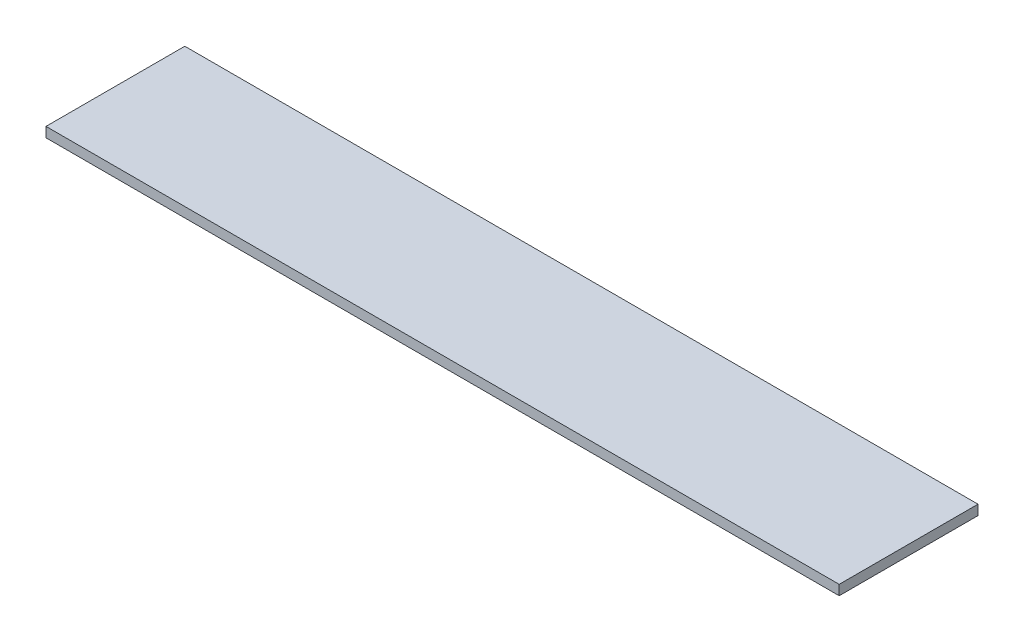
from build123d import *

# Parameters (mm, degrees)
SKETCH1_W           = 254
SKETCH1_H           = 44.45
BOSS_EXTRUDE1_DEPTH = 3.175


with BuildPart() as part:
    # Sketch1 → Boss-Extrude1 (new body)
    with BuildSketch(Plane(origin=(0, 0, 0), x_dir=(1, 0, 0), z_dir=(0, 1, 0))):
        Rectangle(SKETCH1_W, SKETCH1_H)
    extrude(amount=BOSS_EXTRUDE1_DEPTH)


solid = part.part
